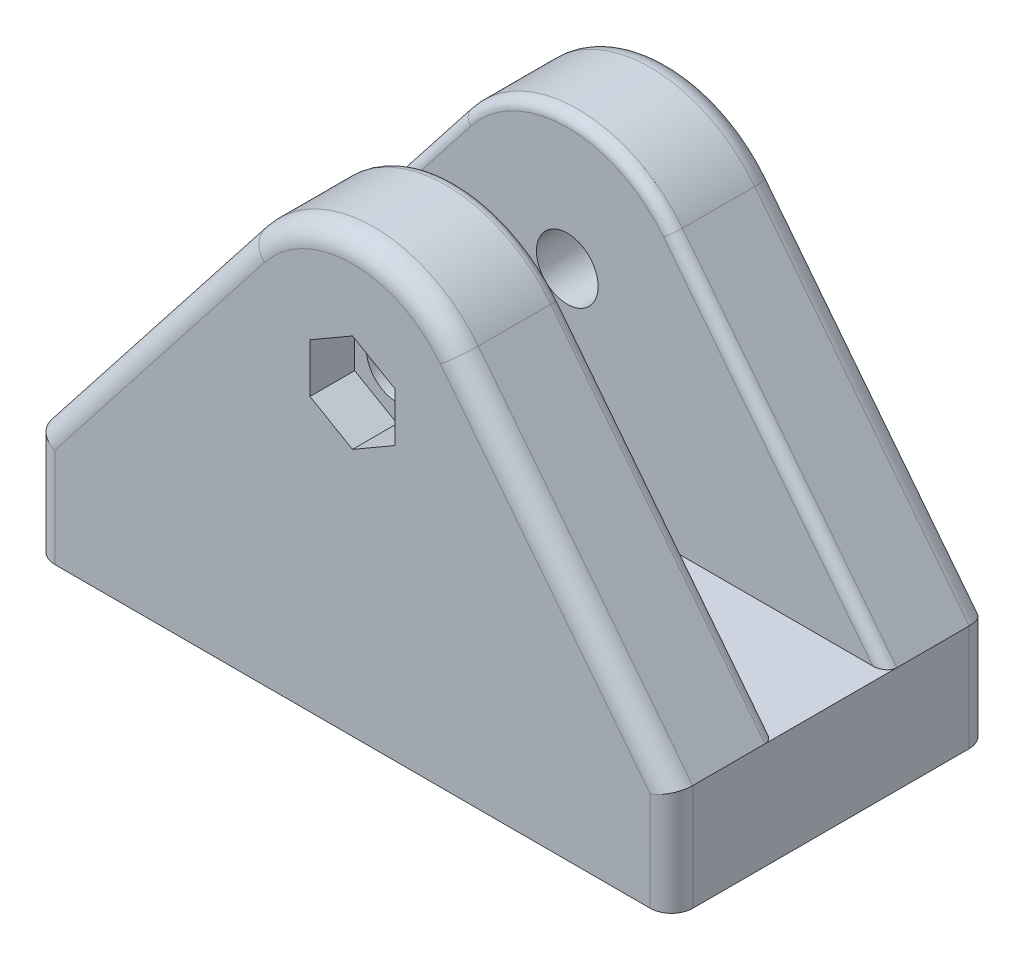
from build123d import *

# Parameters (mm, degrees)
SKETCH_1_W          = 60
SKETCH_1_H          = 30
EXTRUDE_1_DEPTH     = 10
SKETCH_2_R          = 2.9
EXTRUDE_2_DEPTH     = 9.8
EXTRUDE_START       = -9.8
SKETCH_4_R          = 2.9
EXTRUDE_3_DEPTH     = 9.8
SKETCH_5_R          = 2.4
CUT_EXTRUDE_1_DEPTH = 6
CUT_EXTRUDE_2_DEPTH = 4.2
CUT_EXTRUDE_3_DEPTH = 2.4
SKETCH_8_R          = 2.4
CUT_EXTRUDE_4_DEPTH = 47.983082062
FILLET_1_R          = 1
FILLET_2_R          = 2
CHAMFER_5_SIZE      = 1


with BuildPart() as part:
    # 草圖1 → 填料-伸長1 (new body)
    with BuildSketch(Plane(origin=(0, 0, 0), x_dir=(1, 0, 0), z_dir=(0, 1, 0))):
        Rectangle(SKETCH_1_W, SKETCH_1_H)
    extrude(amount=EXTRUDE_1_DEPTH)

    # 草圖2 → 填料-伸長2 (add)
    with BuildSketch(Plane.XY.offset(15)):
        with BuildLine():
            Line((-9.836356149, 35.713371359), (-30, 10))
            Line((-30, 10), (30, 10))
            Line((30, 10), (9.836356149, 35.713371359))
            ThreePointArc((9.836356149, 35.713371359), (0, 40.5), (-9.836356149, 35.713371359))
        make_face()
        with Locations((0, 28)):
            Circle(SKETCH_2_R, mode=Mode.SUBTRACT)
    extrude(amount=-EXTRUDE_2_DEPTH)

    # 草圖4 → 填料-伸長3 (add)
    with BuildSketch(Plane(origin=(0, 0, -15), x_dir=(-1, 0, 0), z_dir=(0, 0, -1)).offset(EXTRUDE_START)):
        with BuildLine():
            Line((30, 10), (9.836356149, 35.713371359))
            ThreePointArc((9.836356149, 35.713371359), (0, 40.5), (-9.836356149, 35.713371359))
            Line((-9.836356149, 35.713371359), (-30, 10))
            Line((-30, 10), (30, 10))
        make_face()
        with Locations(Location((0, 28, 0), (0, 0, 180))):
            Circle(SKETCH_4_R, mode=Mode.SUBTRACT)
    extrude(amount=EXTRUDE_3_DEPTH)

    # 草圖5 → 除料-伸長1 (cut)
    with BuildSketch(Plane.XZ):
        with Locations(Location((20, 10, 0), (0, 0, 270))):
            Circle(SKETCH_5_R)
        with Locations(Location((20, -10, 0), (0, 0, 270))):
            Circle(SKETCH_5_R)
        with Locations(Location((-20, -10, 0), (0, 0, 270))):
            Circle(SKETCH_5_R)
        with Locations(Location((-20, 10, 0), (0, 0, 270))):
            Circle(SKETCH_5_R)
    extrude(amount=-CUT_EXTRUDE_1_DEPTH, mode=Mode.SUBTRACT)

    # 草圖6 → 除料-伸長2 (cut)
    with BuildSketch(Plane.XY.offset(15)):
        Polygon((0, 32.618802154), (-4, 30.309401077), (-4, 25.690598923), (0, 23.381197846), (4, 25.690598923), (4, 30.309401077), align=None)
    extrude(amount=-CUT_EXTRUDE_2_DEPTH, mode=Mode.SUBTRACT)

    # 草圖7 → 除料-伸長3 (cut)
    with BuildSketch(Plane(origin=(0, 10, 0), x_dir=(1, 0, 0), z_dir=(0, 1, 0))):
        Polygon((3.175426481, 0), (1.58771324, 2.75), (-1.58771324, 2.75), (-3.175426481, 0), (-1.58771324, -2.75), (1.58771324, -2.75), align=None)
    extrude(amount=-CUT_EXTRUDE_3_DEPTH, mode=Mode.SUBTRACT)

    # 草圖8 → 除料-伸長4 (cut, through all)
    with BuildSketch(Plane(origin=(0, 7.6, 0), x_dir=(1, 0, 0), z_dir=(0, 1, 0))):
        with Locations(Location((0, 0, 0), (0, 0, 270))):
            Circle(SKETCH_8_R)
    extrude(amount=-CUT_EXTRUDE_4_DEPTH, mode=Mode.SUBTRACT)

    # 圓角1
    fillet_1_edges = [part.edges().sort_by_distance(p)[0] for p in [
        (-19.918178074, 22.856685679, 5.2),
        (0, 40.5, 5.2),
        (19.918178074, 22.856685679, 5.2),
        (0, 40.5, -5.2),
        (-19.918178074, 22.856685679, -5.2),
        (19.918178074, 22.856685679, -5.2),
    ]]
    fillet(fillet_1_edges, radius=FILLET_1_R)

    # 圓角2
    fillet_2_edges = [part.edges().sort_by_distance(p)[0] for p in [
        (19.918178074, 22.856685679, 15),
        (0, 40.5, 15),
        (-19.918178074, 22.856685679, 15),
        (0, 40.5, -15),
        (19.918178074, 22.856685679, -15),
        (-19.918178074, 22.856685679, -15),
        (30, 5, 15),
        (-30, 5, 15),
        (-30, 5, -15),
        (30, 5, -15),
    ]]
    fillet(fillet_2_edges, radius=FILLET_2_R)

    # 導角5
    chamfer_5_edges = [part.edges().sort_by_distance(p)[0] for p in [
        (2.38156986, 10, 1.375),
        (2.38156986, 10, -1.375),
        (0, 10, -2.75),
        (-2.38156986, 10, -1.375),
        (-2.38156986, 10, 1.375),
        (0, 10, 2.75),
    ]]
    chamfer(chamfer_5_edges, length=CHAMFER_5_SIZE)


solid = part.part
